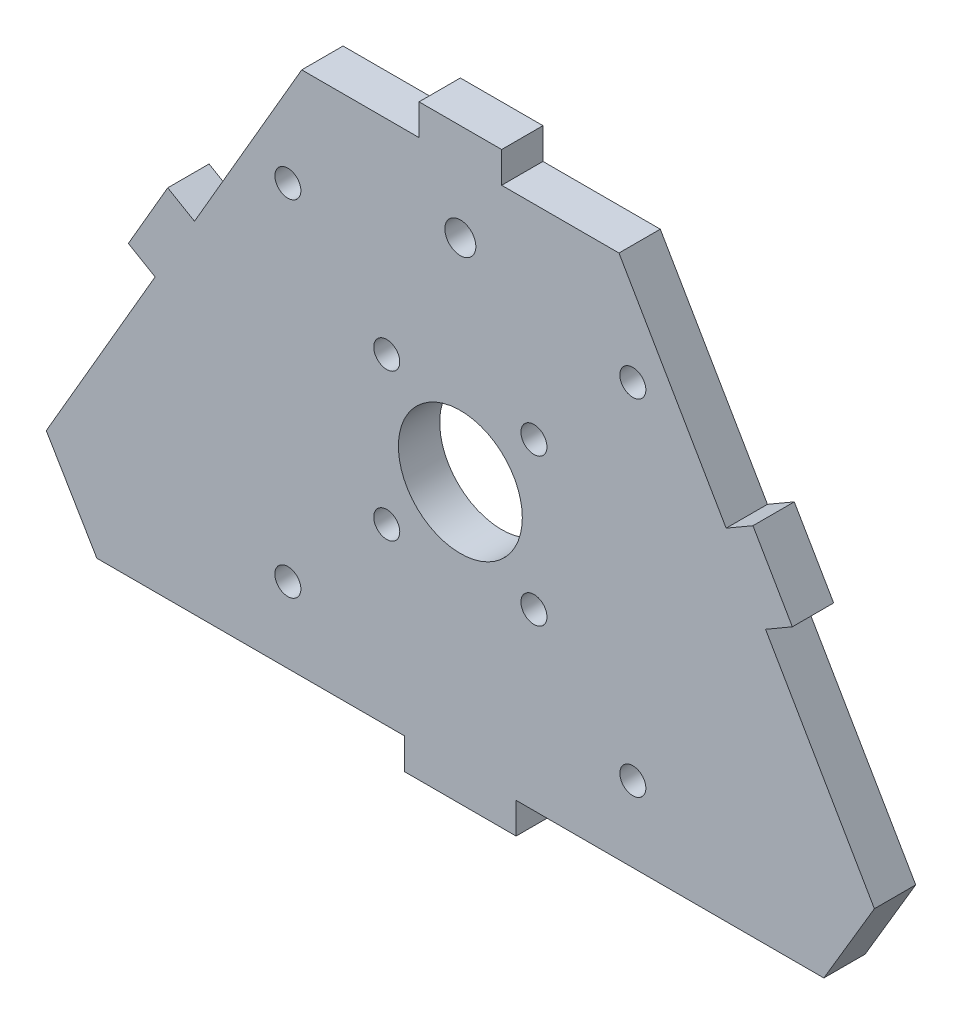
from build123d import *

# Parameters (mm, degrees)
BOSS_EXTRUDE1_DEPTH = 6.35
SKETCH3_R           = 9.525
SKETCH3_R_2         = 2
SKETCH3_R_3         = 2.38125
CUT_EXTRUDE1_DEPTH  = 6.35
SKETCH4_W           = 17.145
SKETCH4_H           = 6.35
BOSS_EXTRUDE2_DEPTH = 4.7625
SKETCH5_W           = 6.35
SKETCH5_H           = 12.065
BOSS_EXTRUDE3_DEPTH = 4.7625
SKETCH6_W           = 6.35
SKETCH6_H           = 12.065
BOSS_EXTRUDE4_DEPTH = 4.7625
SKETCH7_W           = 12.7
SKETCH7_H           = 6.35
BOSS_EXTRUDE5_DEPTH = 4.7625


with BuildPart() as part:
    # Sketch2 → Boss-Extrude1 (new body)
    with BuildSketch(Plane.XY):
        Polygon((24.384, 80.772), (-24.384, 80.772), (-63.652178597, 13.109189138), (-55.88, 0), (55.88, 0), (63.652178597, 13.109189138), align=None)
    extrude(amount=BOSS_EXTRUDE1_DEPTH)

    # Sketch3 → Cut-Extrude1 (cut)
    with BuildSketch(Plane.XY.offset(6.35)):
        with Locations((0, 38.1)):
            Circle(SKETCH3_R)
        with Locations((-11.313708499, 49.413708499)):
            Circle(SKETCH3_R_2)
        with Locations((-11.313708499, 26.786291501)):
            Circle(SKETCH3_R_2)
        with Locations((11.313708499, 26.786291501)):
            Circle(SKETCH3_R_2)
        with Locations((11.313708499, 49.413708499)):
            Circle(SKETCH3_R_2)
        with Locations((26.516504294, 64.616504294)):
            Circle(SKETCH3_R_2)
        with Locations((-26.516504294, 64.616504294)):
            Circle(SKETCH3_R_2)
        with Locations((-26.516504294, 11.583495706)):
            Circle(SKETCH3_R_2)
        with Locations((26.516504294, 11.583495706)):
            Circle(SKETCH3_R_2)
        with Locations((0, 70.612)):
            Circle(SKETCH3_R_3)
    extrude(amount=-CUT_EXTRUDE1_DEPTH, mode=Mode.SUBTRACT)

    # Sketch4 → Boss-Extrude2 (add)
    with BuildSketch(Plane.XZ):
        with Locations((0, 3.175)):
            Rectangle(SKETCH4_W, SKETCH4_H)
    extrude(amount=BOSS_EXTRUDE2_DEPTH)

    # Sketch5 → Boss-Extrude3 (add)
    with BuildSketch(Plane(origin=(-53.306195658, 30.936302893, 0), x_dir=(0, 0, 1), z_dir=(-0.8648994127942479, 0.5019452218600805, 0))):
        with Locations((3.175, 18.75822308)):
            Rectangle(SKETCH5_W, SKETCH5_H)
    extrude(amount=BOSS_EXTRUDE3_DEPTH)

    # Sketch6 → Boss-Extrude4 (add)
    with BuildSketch(Plane(origin=(53.306195658, 30.936302893, 0), x_dir=(0, 0, -1), z_dir=(0.8648994127942479, 0.5019452218600805, 0))):
        with Locations((-3.175, 18.75822308)):
            Rectangle(SKETCH6_W, SKETCH6_H)
    extrude(amount=BOSS_EXTRUDE4_DEPTH)

    # Sketch7 → Boss-Extrude5 (add)
    with BuildSketch(Plane(origin=(0, 80.772, 0), x_dir=(1, 0, 0), z_dir=(0, 1, 0))):
        with Locations((0, -3.175)):
            Rectangle(SKETCH7_W, SKETCH7_H)
    extrude(amount=BOSS_EXTRUDE5_DEPTH)


solid = part.part
